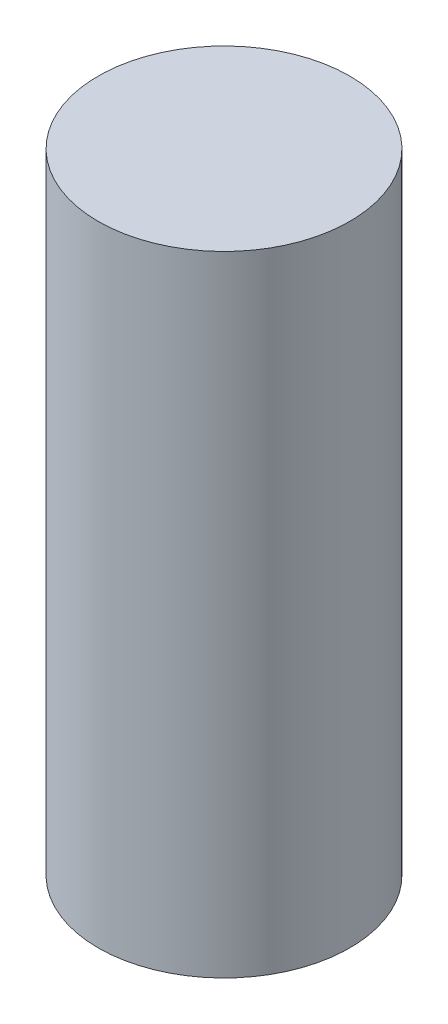
from build123d import *

# Parameters (mm, degrees)
CROQUIS2_W = 20
CROQUIS2_H = 100


with BuildPart() as part:
    # Croquis2 → Revolución1 (revolve)
    with BuildSketch(Plane.XY, mode=Mode.PRIVATE) as revoluci_n1_sk:
        with Locations((10, 50)):
            Rectangle(CROQUIS2_W, CROQUIS2_H)
    revolve(revoluci_n1_sk.sketch.rotate(Axis((0, 0, 0), (0, 1, 0)), 90), axis=Axis((0, 0, 0), (0, 1, 0)))


solid = part.part
